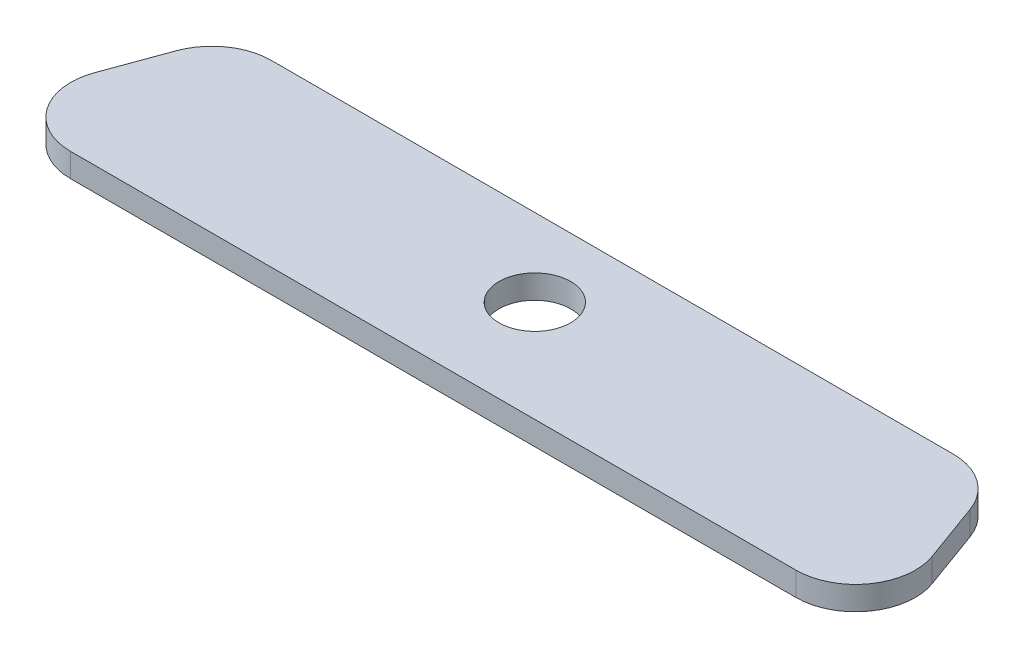
from build123d import *

# Parameters (mm, degrees)
SKETCH1_R           = 1.2
BOSS_EXTRUDE1_DEPTH = 0.79375
FILLET1_R           = 2


with BuildPart() as part:
    # Sketch1 → Boss-Extrude1 (new body)
    with BuildSketch(Plane(origin=(0, 0, 0), x_dir=(1, 0, 0), z_dir=(0, 1, 0))):
        Polygon((0, 0), (30, 0), (27.816178594, 6), (2.183821406, 6), align=None)
        with Locations(Location((15, 3.4, 0), (0, 0, 270))):
            Circle(SKETCH1_R, mode=Mode.SUBTRACT)
    extrude(amount=BOSS_EXTRUDE1_DEPTH)

    # Fillet1
    fillet1_edges = [part.edges().sort_by_distance(p)[0] for p in [
        (2.183821406, 0.396875, -6),
        (27.816178594, 0.396875, -6),
        (30, 0.396875, 0),
        (0, 0.396875, 0),
    ]]
    fillet(fillet1_edges, radius=FILLET1_R)


solid = part.part
